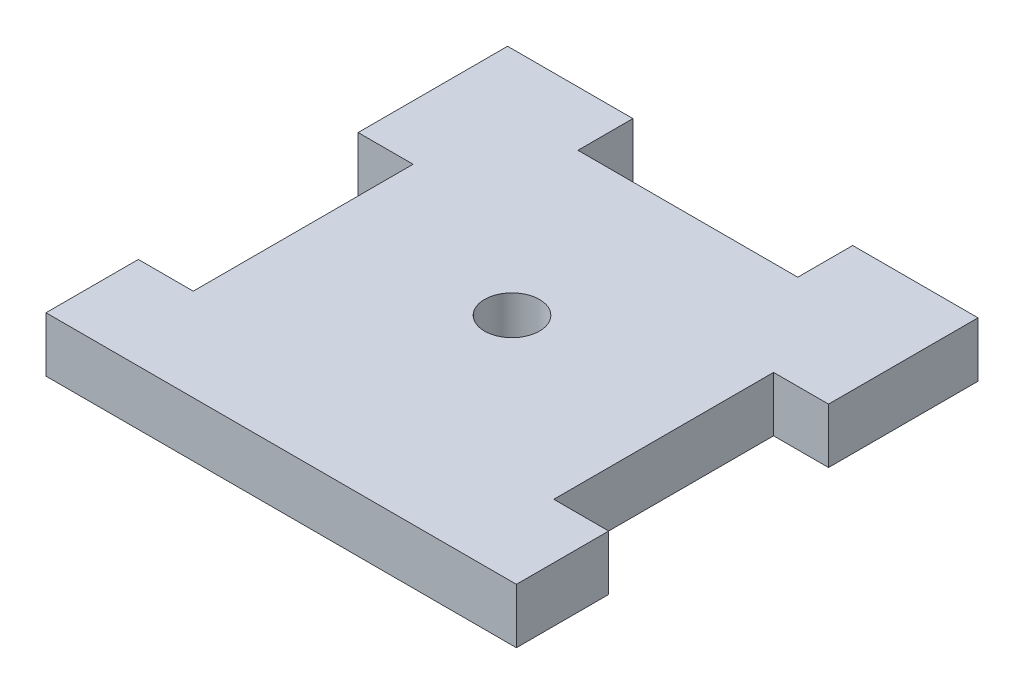
from build123d import *

# Parameters (mm, degrees)
SKETCH1_R      = 3.175
EXTRUDE1_DEPTH = 6.35


with BuildPart() as part:
    # Sketch1 → Extrude1 (new body)
    with BuildSketch(Plane(origin=(0, 0, 0), x_dir=(1, 0, 0), z_dir=(0, 1, 0))):
        Polygon((14.478, 53.34), (14.478, 46.99), (39.878, 46.99), (39.878, 53.34), (54.356, 53.34), (54.356, 36.068), (48.006, 36.068), (48.006, 10.668), (54.356, 10.668), (54.356, 0), (0, 0), (0, 10.668), (6.35, 10.668), (6.35, 36.068), (0, 36.068), (0, 53.34), align=None)
        with Locations(Location((27.178, 26.67, 0), (0, 0, 270))):
            Circle(SKETCH1_R, mode=Mode.SUBTRACT)
    extrude(amount=EXTRUDE1_DEPTH)


solid = part.part
